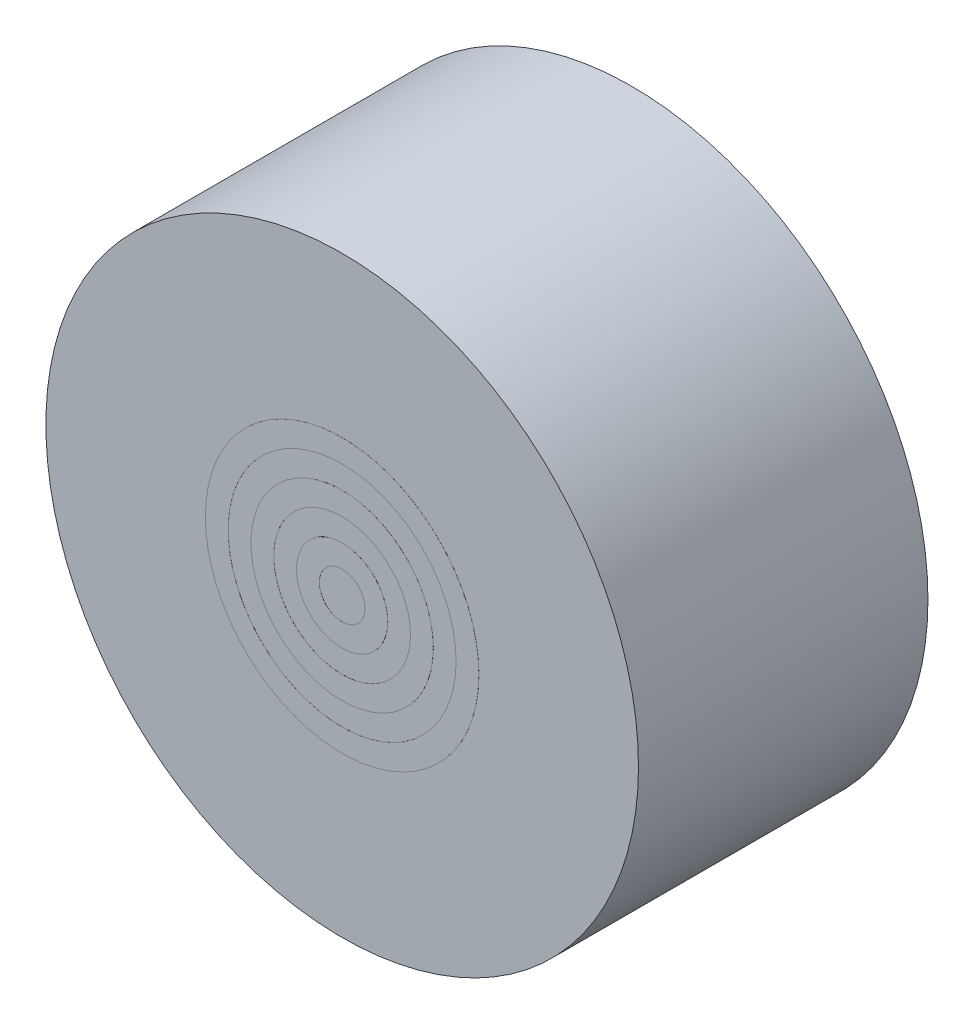
from build123d import *

# Parameters (mm, degrees)
SKETCH2_R      = 0.5
F_0TO0_5_DEPTH = 6.349
SKETCH3_R      = 1
SKETCH3_R_2    = 0.5
F_0_5TO1_DEPTH = 6.351
SKETCH4_R      = 1.5
SKETCH4_R_2    = 1
F_1TO1_5_DEPTH = 6.349
SKETCH5_R      = 2
SKETCH5_R_2    = 1.5
F_1_5TO2_DEPTH = 6.351
SKETCH6_R      = 2.5
SKETCH6_R_2    = 2
F_2TO2_5_DEPTH = 6.349
SKETCH7_R      = 3
SKETCH7_R_2    = 2.5
F_2_5TO3_DEPTH = 6.351
SKETCH8_R      = 6.5
MIRROR_2_DEPTH = 6.35


with BuildPart() as part:
    # Sketch2 → 0to0.5 (new body)
    with BuildSketch(Plane.XY):
        Circle(SKETCH2_R)
    extrude(amount=F_0TO0_5_DEPTH)

    # Sketch3 → 0.5to1 (add)
    with BuildSketch(Plane.XY):
        Circle(SKETCH3_R)
        Circle(SKETCH3_R_2, mode=Mode.SUBTRACT)
    extrude(amount=F_0_5TO1_DEPTH)

    # Sketch4 → 1to1.5 (add)
    with BuildSketch(Plane.XY):
        Circle(SKETCH4_R)
        Circle(SKETCH4_R_2, mode=Mode.SUBTRACT)
    extrude(amount=F_1TO1_5_DEPTH)

    # Sketch5 → 1.5to2 (add)
    with BuildSketch(Plane.XY):
        Circle(SKETCH5_R)
        Circle(SKETCH5_R_2, mode=Mode.SUBTRACT)
    extrude(amount=F_1_5TO2_DEPTH)

    # Sketch6 → 2to2.5 (add)
    with BuildSketch(Plane.XY):
        Circle(SKETCH6_R)
        Circle(SKETCH6_R_2, mode=Mode.SUBTRACT)
    extrude(amount=F_2TO2_5_DEPTH)

    # Sketch7 → 2.5to3 (add)
    with BuildSketch(Plane.XY):
        Circle(SKETCH7_R)
        Circle(SKETCH7_R_2, mode=Mode.SUBTRACT)
    extrude(amount=F_2_5TO3_DEPTH)

    # Sketch8 → Mirror 2 (add)
    with BuildSketch(Plane.XY):
        Circle(SKETCH8_R)
    extrude(amount=MIRROR_2_DEPTH)


solid = part.part
